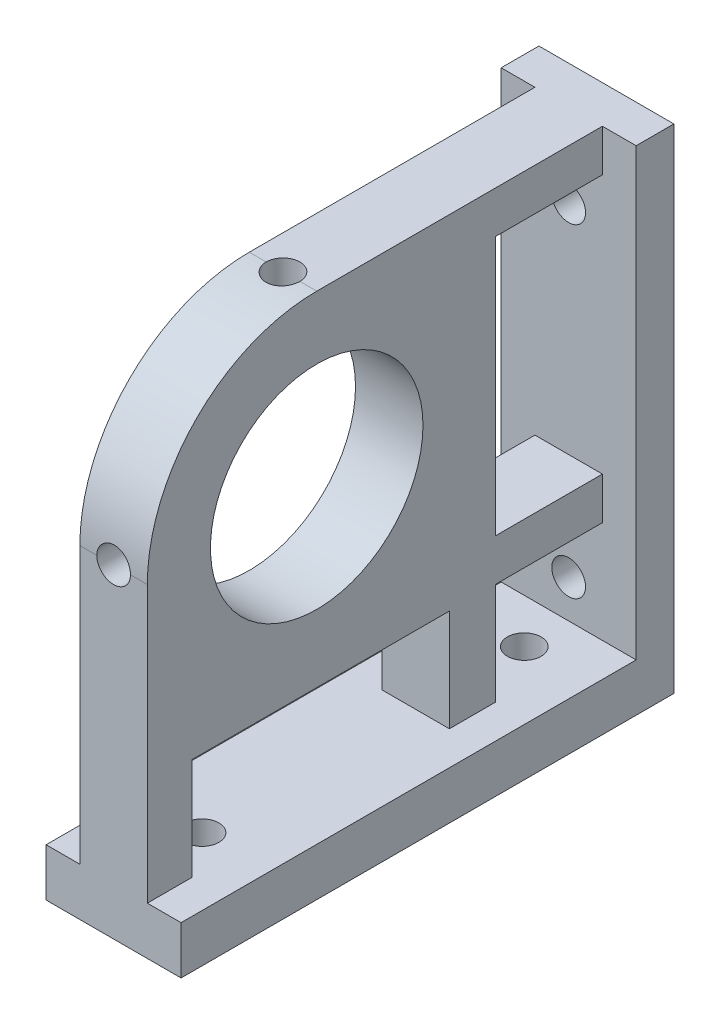
from build123d import *

# Parameters (mm, degrees)
SKETCH1_R                = 20
BOSS_EXTRUDE1_DEPTH      = 12.7
BOSS_EXTRUDE2_DEPTH      = 6.35
BOSS_EXTRUDE2_DEPTH_BACK = 19.05
SKETCH2_R                = 3.175
CUT_EXTRUDE1_DEPTH       = 89.231203407
SKETCH10_R               = 3.175
CUT_EXTRUDE6_DEPTH       = 8.128
SKETCH4_W                = 20.078494948
SKETCH4_H                = 48.78095735
SKETCH4_W_2              = 48.420880553
SKETCH4_H_2              = 19.195923741
CUT_EXTRUDE2_DEPTH       = 26.162
SKETCH5_R                = 3.175
CUT_EXTRUDE3_DEPTH       = 11.43
SKETCH6_R                = 3.175
CUT_EXTRUDE4_DEPTH       = 11.43


with BuildPart() as part:
    # Sketch1 → Boss-Extrude1 (new body)
    with BuildSketch(Plane(origin=(0, 0, 0), x_dir=(0, 0, -1), z_dir=(1, 0, 0))):
        with BuildLine():
            Line((0, 31.882172919), (31.882172919, 31.882172919))
            Line((31.882172919, 31.882172919), (60.87463474, 31.882172919))
            Line((60.87463474, 31.882172919), (60.87463474, -60.96))
            Line((60.87463474, -60.96), (-31.882172919, -60.96))
            Line((-31.882172919, -60.96), (-31.882172919, 0))
            ThreePointArc((-31.882172919, 0), (-22.54410067, 22.54410067), (0, 31.882172919))
        make_face()
        Circle(SKETCH1_R, mode=Mode.SUBTRACT)
    extrude(amount=BOSS_EXTRUDE1_DEPTH)

    # Sketch8 → Boss-Extrude2 (add, two sides: drawn at the far end of the back side and taken through both)
    with BuildSketch(Plane(origin=(12.7, 0, 0), x_dir=(0, 0, -1), z_dir=(1, 0, 0)).offset(-BOSS_EXTRUDE2_DEPTH_BACK)):
        Polygon((60.87463474, 31.882172919), (53.770648903, 31.882172919), (53.770648903, -51.937867719), (-31.882172919, -51.937867719), (-31.882172919, -60.96), (53.770648903, -60.96), (60.87463474, -60.96), align=None)
    extrude(amount=BOSS_EXTRUDE2_DEPTH + BOSS_EXTRUDE2_DEPTH_BACK)

    # Sketch2 → Cut-Extrude1 (cut, through all)
    with BuildSketch(Plane(origin=(0, 0, 0), x_dir=(1, 0, 0), z_dir=(0, 1, 0))):
        with Locations((6.35, 0)):
            Circle(SKETCH2_R)
    extrude(amount=CUT_EXTRUDE1_DEPTH, mode=Mode.SUBTRACT)

    # Sketch10 → Cut-Extrude6 (cut)
    with BuildSketch(Plane.XY.offset(31.882172919)):
        with Locations((6.35, 0)):
            Circle(SKETCH10_R)
    extrude(amount=-CUT_EXTRUDE6_DEPTH, mode=Mode.SUBTRACT)

    # Sketch4 → Cut-Extrude2 (cut)
    with BuildSketch(Plane.ZY):
        with Locations((-43.731401429, -0.427222634)):
            Rectangle(SKETCH4_W, SKETCH4_H)
        with Locations((-0.75610861, -42.339905849)):
            Rectangle(SKETCH4_W_2, SKETCH4_H_2)
        with Locations((-43.731401429, -42.339905849)):
            Rectangle(SKETCH4_W, SKETCH4_H_2)
    extrude(amount=-CUT_EXTRUDE2_DEPTH, mode=Mode.SUBTRACT)

    # Sketch5 → Cut-Extrude3 (cut)
    with BuildSketch(Plane(origin=(0, 0, -60.87463474), x_dir=(-1, 0, 0), z_dir=(0, 0, -1))):
        with Locations((-6.35, 16.187024645)):
            Circle(SKETCH5_R)
        with Locations((-6.35, -44.788648077)):
            Circle(SKETCH5_R)
    extrude(amount=-CUT_EXTRUDE3_DEPTH, mode=Mode.SUBTRACT)

    # Sketch6 → Cut-Extrude4 (cut)
    with BuildSketch(Plane.XZ.offset(60.96)):
        with Locations((6.35, 15.24)):
            Circle(SKETCH6_R)
        with Locations((6.35, -45.41055385)):
            Circle(SKETCH6_R)
    extrude(amount=-CUT_EXTRUDE4_DEPTH, mode=Mode.SUBTRACT)


solid = part.part
